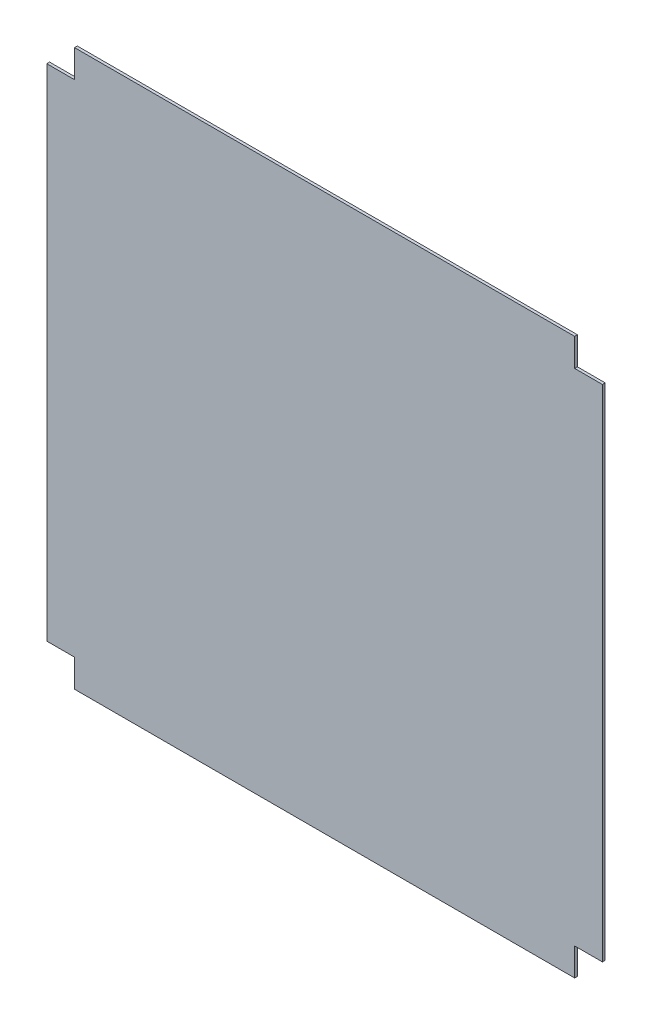
from build123d import *

# Parameters (mm, degrees)
BOSS_EXTRUDE1_DEPTH = 2


with BuildPart() as part:
    # Sketch1 → Boss-Extrude1 (new body)
    with BuildSketch(Plane(origin=(0, 0, 0), x_dir=(0, 1, 0), z_dir=(0, 0, 1))):
        Polygon((380, -20), (380, 0), (20, 0), (20, -20), (0, -20), (0, -380), (20, -380), (20, -400), (380, -400), (380, -380), (400, -380), (400, -20), align=None)
    extrude(amount=BOSS_EXTRUDE1_DEPTH)


solid = part.part
